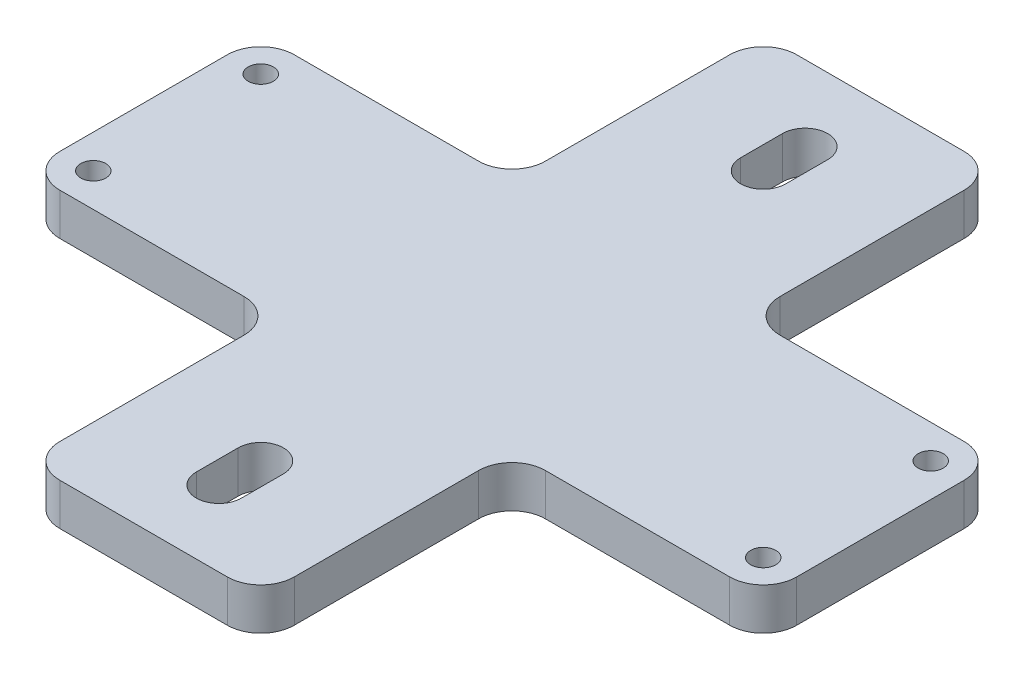
from build123d import *

# Parameters (mm, degrees)
SKETCH_1_R      = 1.5
EXTRUDE_1_DEPTH = 5


with BuildPart() as part:
    # 草图1 → 凸台-拉伸1 (new body)
    with BuildSketch(Plane(origin=(0, 0, 0), x_dir=(1, 0, 0), z_dir=(0, 1, 0))):
        with BuildLine():
            Line((14, -40), (14, -18))
            ThreePointArc((14, -18), (15.171572875, -15.171572875), (18, -14))
            Line((18, -14), (40, -14))
            ThreePointArc((40, -14), (42.828427125, -12.828427125), (44, -10))
            Line((44, -10), (44, 10))
            ThreePointArc((44, 10), (42.828427125, 12.828427125), (40, 14))
            Line((40, 14), (18, 14))
            ThreePointArc((18, 14), (15.171572875, 15.171572875), (14, 18))
            Line((14, 18), (14, 40))
            ThreePointArc((14, 40), (12.828427125, 42.828427125), (10, 44))
            Line((10, 44), (-10, 44))
            ThreePointArc((-10, 44), (-12.828427125, 42.828427125), (-14, 40))
            Line((-14, 40), (-14, 18))
            ThreePointArc((-14, 18), (-15.171572875, 15.171572875), (-18, 14))
            Line((-18, 14), (-40, 14))
            ThreePointArc((-40, 14), (-42.828427125, 12.828427125), (-44, 10))
            Line((-44, 10), (-44, -10))
            ThreePointArc((-44, -10), (-42.828427125, -12.828427125), (-40, -14))
            Line((-40, -14), (-18, -14))
            ThreePointArc((-18, -14), (-15.171572875, -15.171572875), (-14, -18))
            Line((-14, -18), (-14, -40))
            ThreePointArc((-14, -40), (-12.828427125, -42.828427125), (-10, -44))
            Line((-10, -44), (10, -44))
            ThreePointArc((10, -44), (12.828427125, -42.828427125), (14, -40))
        make_face()
        with Locations(Location((40, 10, 0), (0, 0, 270))):
            Circle(SKETCH_1_R, mode=Mode.SUBTRACT)
        with Locations(Location((40, -10, 0), (0, 0, 270))):
            Circle(SKETCH_1_R, mode=Mode.SUBTRACT)
        with Locations(Location((-40, 10, 0), (0, 0, 270))):
            Circle(SKETCH_1_R, mode=Mode.SUBTRACT)
        with Locations(Location((-40, -10, 0), (0, 0, 270))):
            Circle(SKETCH_1_R, mode=Mode.SUBTRACT)
        with BuildLine():
            ThreePointArc((-2.7, 30), (0, 27.3), (2.7, 30))
            Line((2.7, 30), (2.7, 35))
            ThreePointArc((2.7, 35), (0, 37.7), (-2.7, 35))
            Line((-2.7, 35), (-2.7, 30))
        make_face(mode=Mode.SUBTRACT)
        with BuildLine():
            ThreePointArc((2.7, -30), (0, -27.3), (-2.7, -30))
            Line((-2.7, -30), (-2.7, -35))
            ThreePointArc((-2.7, -35), (0, -37.7), (2.7, -35))
            Line((2.7, -35), (2.7, -30))
        make_face(mode=Mode.SUBTRACT)
    extrude(amount=EXTRUDE_1_DEPTH)


solid = part.part
